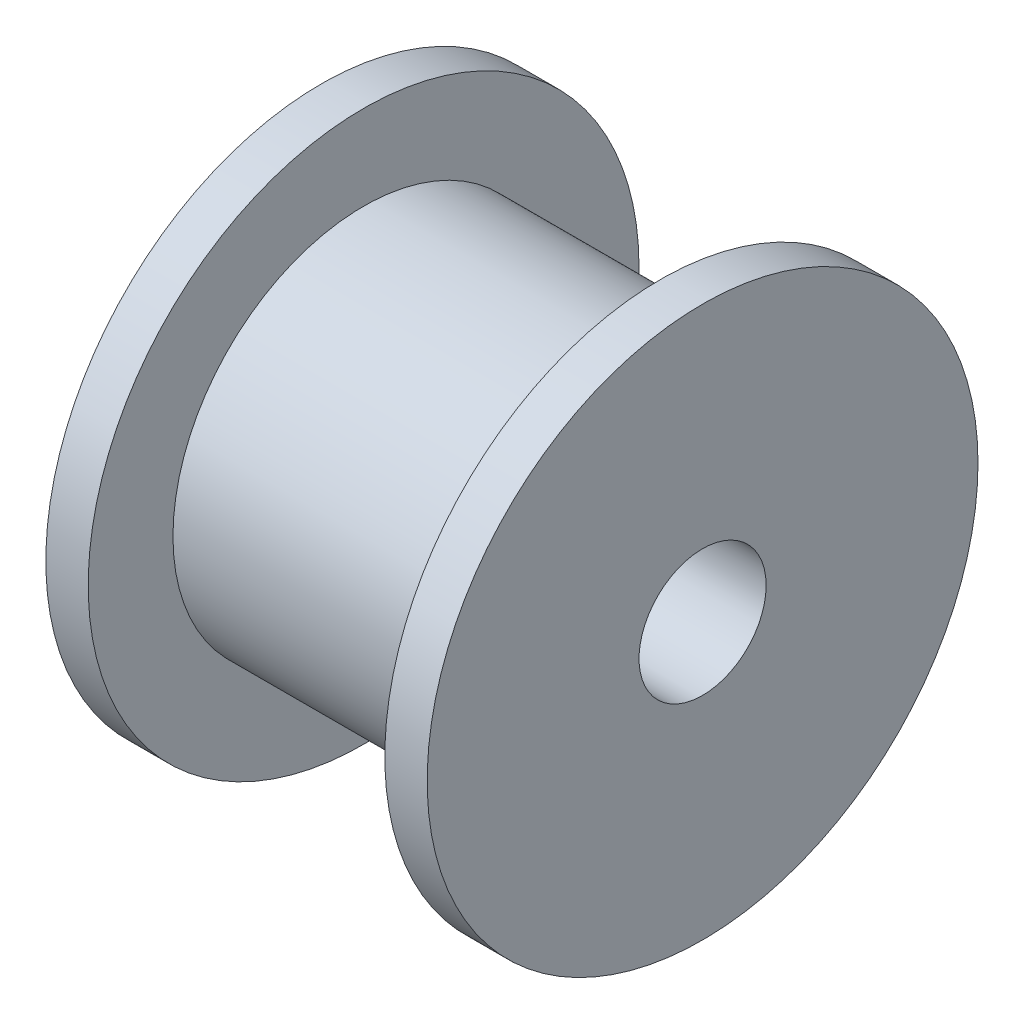
from build123d import *

# Parameters (mm, degrees)
BOSS_EXTRUDE1_DEPTH      = 4.5
BOSS_EXTRUDE1_DEPTH_BACK = 4.5
SKETCH1_R                = 6.5
SKETCH1_R_2              = 1.5
CUT_EXTRUDE1_DEPTH       = 3.5
CUT_EXTRUDE1_DEPTH_BACK  = 3.5
SKETCH1_3_R              = 6.5
SKETCH1_3_R_2            = 4.5


with BuildPart() as part:
    # Sketch1 → Boss-Extrude1 (new, two sides: drawn at the far end of the back side and taken through both)
    with BuildSketch(Plane(origin=(0, 0, 0), x_dir=(0, 0, -1), z_dir=(1, 0, 0)).offset(-BOSS_EXTRUDE1_DEPTH_BACK)):
        Circle(SKETCH1_R)
        Circle(SKETCH1_R_2, mode=Mode.SUBTRACT)
    extrude(amount=BOSS_EXTRUDE1_DEPTH + BOSS_EXTRUDE1_DEPTH_BACK)

    # Sketch1<3> → Cut-Extrude1 (cut, two sides: drawn at the far end of the back side and taken through both)
    with BuildSketch(Plane(origin=(0, 0, 0), x_dir=(0, 0, -1), z_dir=(1, 0, 0)).offset(-CUT_EXTRUDE1_DEPTH_BACK)):
        Circle(SKETCH1_3_R)
        Circle(SKETCH1_3_R_2, mode=Mode.SUBTRACT)
    extrude(amount=CUT_EXTRUDE1_DEPTH + CUT_EXTRUDE1_DEPTH_BACK, mode=Mode.SUBTRACT)


solid = part.part
